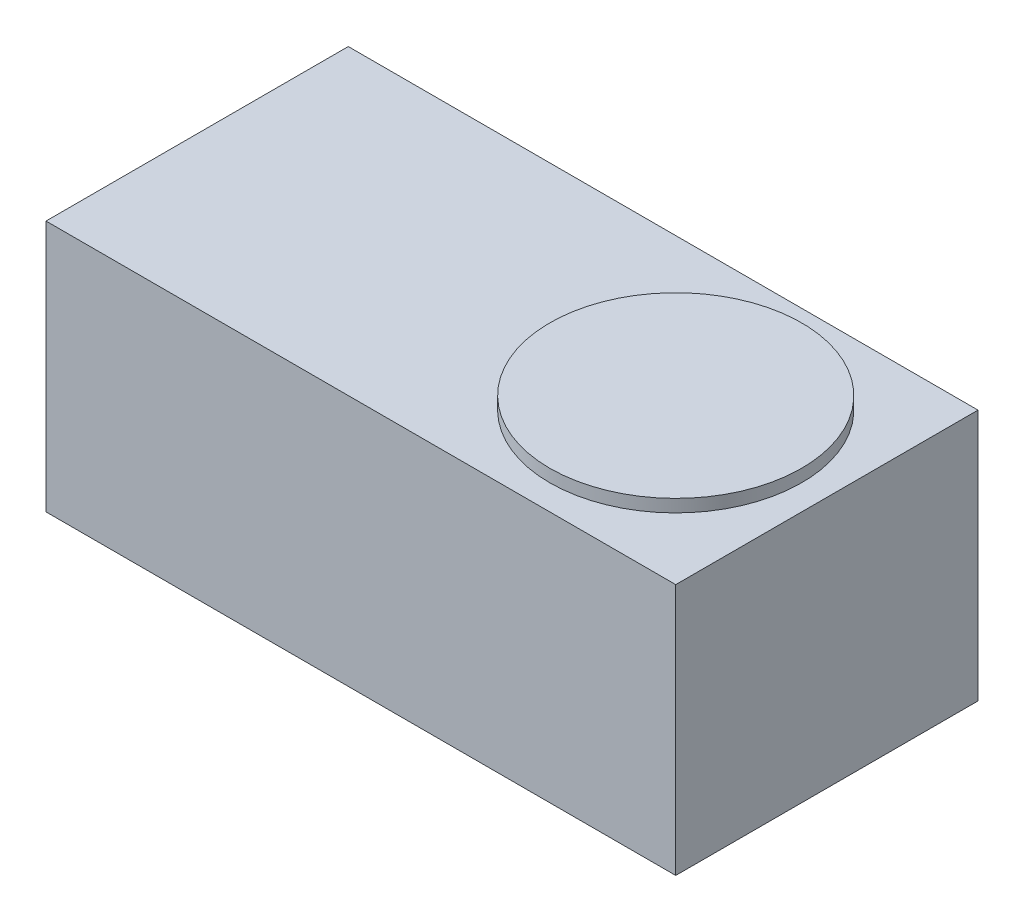
from build123d import *

# Parameters (mm, degrees)
SKETCH2_R           = 10
BOSS_EXTRUDE1_DEPTH = 1
SKETCH4_W           = 50
SKETCH4_H           = 24
BOSS_EXTRUDE2_DEPTH = 20


with BuildPart() as part:
    # Sketch2 → Boss-Extrude1 (new body)
    with BuildSketch(Plane(origin=(0, 0, 0), x_dir=(1, 0, 0), z_dir=(0, 1, 0))):
        with Locations(Location((0, 0, 0), (0, 0, 270))):
            Circle(SKETCH2_R)
    extrude(amount=-BOSS_EXTRUDE1_DEPTH)

    # Sketch4 → Boss-Extrude2 (add)
    with BuildSketch(Plane(origin=(0, -1, 0), x_dir=(1, 0, 0), z_dir=(0, 1, 0))):
        with Locations((-13, 0)):
            Rectangle(SKETCH4_W, SKETCH4_H)
    extrude(amount=-BOSS_EXTRUDE2_DEPTH)


solid = part.part
